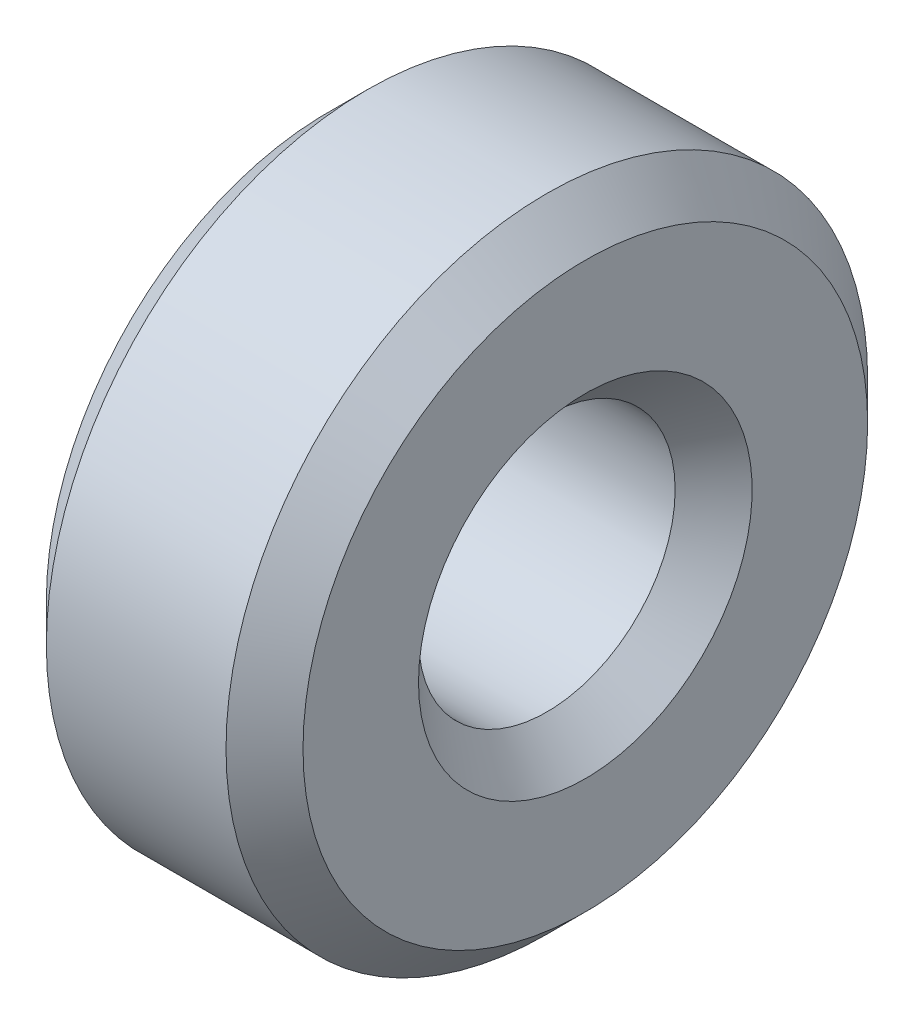
from build123d import *

# Parameters (mm, degrees)
SKICA1_W     = 2
SKICA1_H     = 1.5
ZKOSIT1_SIZE = 0.3


with BuildPart() as part:
    # Skica1 → Otočit kolem osy1 (revolve)
    with BuildSketch(Plane.XY, mode=Mode.PRIVATE) as oto_it_kolem_osy1_sk:
        with Locations((1, 1.75)):
            Rectangle(SKICA1_W, SKICA1_H)
    revolve(oto_it_kolem_osy1_sk.sketch.rotate(Axis((0, 0, 0), (1, 0, 0)), 90), axis=Axis((0, 0, 0), (1, 0, 0)))

    # Zkosit1
    zkosit1_edges = [part.edges().sort_by_distance(p)[0] for p in [
        (0, 0, -2.5),
        (0, 0, -1),
        (2, 0, -1),
        (2, 0, -2.5),
    ]]
    chamfer(zkosit1_edges, length=ZKOSIT1_SIZE)


solid = part.part
